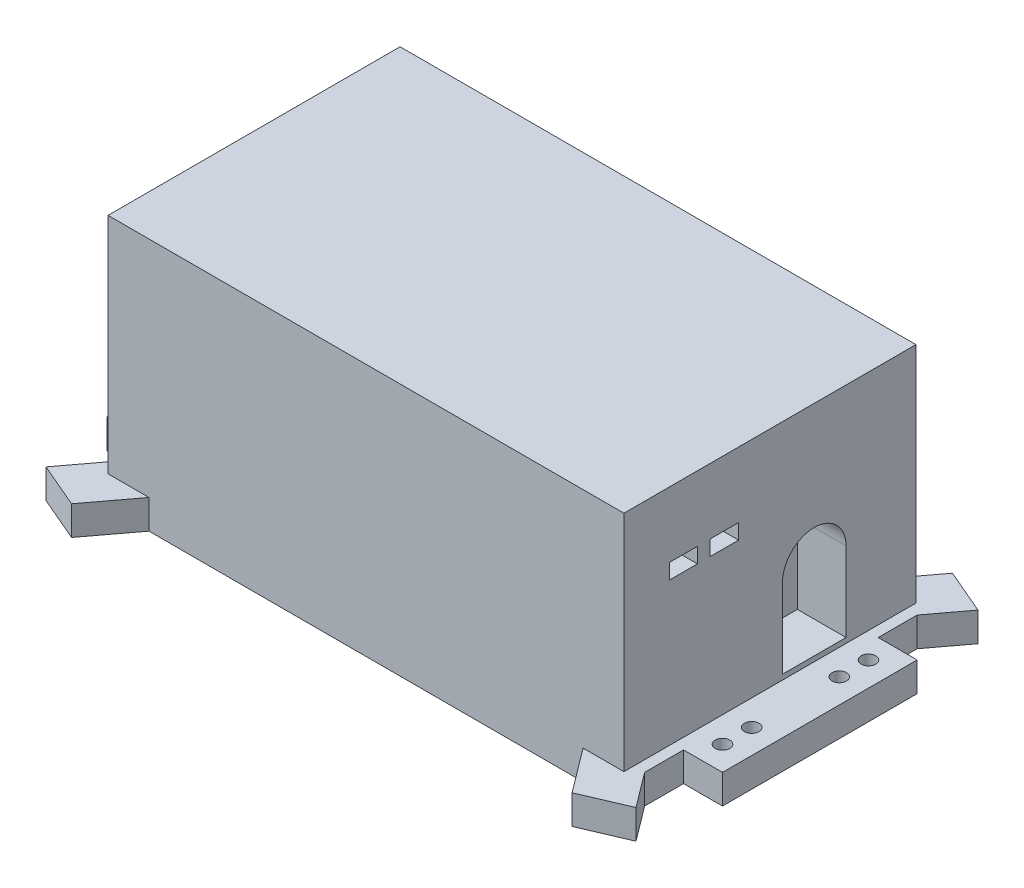
from build123d import *

# Parameters (mm, degrees)
SKETCH_1_R          = 1.5
EXTRUDE_1_DEPTH     = 6
SKETCH_2_W          = 106
SKETCH_2_H          = 60
EXTRUDE_2_DEPTH     = 46
SKETCH_3_R          = 2.913601035
SKETCH_3_W          = 27.829913336
SKETCH_3_H          = 14.266598172
SKETCH_3_W_2        = 28.231789341
SKETCH_3_W_3        = 5.927671071
SKETCH_3_H_2        = 3.014070036
SKETCH_3_W_4        = 6.731423082
SKETCH_3_H_3        = 3.918291047
CUT_EXTRUDE_1_DEPTH = 2
SKETCH_4_W          = 5.850937101
SKETCH_4_H          = 3.132319863
SKETCH_4_W_2        = 5.791836726
CUT_EXTRUDE_2_DEPTH = 10
SKETCH_5_W          = 25.590462272
SKETCH_5_H          = 8.924156589
CUT_EXTRUDE_3_DEPTH = 10


with BuildPart() as part:
    # 草图1 → 凸台-拉伸1 (new body)
    with BuildSketch(Plane(origin=(0, 0, 0), x_dir=(1, 0, 0), z_dir=(0, 1, 0))):
        Polygon((44.601753779, -30), (-44.601753779, -30), (-51.423054046, -39.075905643), (-60.615391847, -35.138784137), (-55.25, -28), (-55.25, -20), (-63.25, -20), (-63.25, 20), (-55.25, 20), (-55.25, 28), (-60.615391847, 35.138784137), (-51.423054046, 39.075905643), (-44.601753779, 30), (44.601753779, 30), (51.423054046, 39.075905643), (60.615391847, 35.138784137), (55.25, 28), (55.25, 20), (63.25, 20), (63.25, -20), (55.25, -20), (55.25, -28), (60.615391847, -35.138784137), (51.423054046, -39.075905643), align=None)
        with Locations(Location((58.25, 15, 0), (0, 0, 270))):
            Circle(SKETCH_1_R, mode=Mode.SUBTRACT)
        with Locations(Location((-58.25, 15, 0), (0, 0, 270))):
            Circle(SKETCH_1_R, mode=Mode.SUBTRACT)
        with Locations(Location((58.25, 9, 0), (0, 0, 270))):
            Circle(SKETCH_1_R, mode=Mode.SUBTRACT)
        with Locations(Location((-58.25, 9, 0), (0, 0, 270))):
            Circle(SKETCH_1_R, mode=Mode.SUBTRACT)
        with Locations(Location((58.25, -9, 0), (0, 0, 90))):
            Circle(SKETCH_1_R, mode=Mode.SUBTRACT)
        with Locations(Location((58.25, -15, 0), (0, 0, 90))):
            Circle(SKETCH_1_R, mode=Mode.SUBTRACT)
        with Locations(Location((-58.25, -9, 0), (0, 0, 90))):
            Circle(SKETCH_1_R, mode=Mode.SUBTRACT)
        with Locations(Location((-58.25, -15, 0), (0, 0, 90))):
            Circle(SKETCH_1_R, mode=Mode.SUBTRACT)
    extrude(amount=EXTRUDE_1_DEPTH)

    # 草图2 → 凸台-拉伸2 (add)
    with BuildSketch(Plane(origin=(0, 6, 0), x_dir=(1, 0, 0), z_dir=(0, 1, 0))):
        Rectangle(SKETCH_2_W, SKETCH_2_H)
    extrude(amount=EXTRUDE_2_DEPTH)

    # 草图3 → 切除-拉伸1 (cut)
    with BuildSketch(Plane(origin=(0, 0, -30), x_dir=(-1, 0, 0), z_dir=(0, 0, -1))):
        with Locations((7.233768087, 14.983525058)):
            Circle(SKETCH_3_R)
        with Locations((-28.282023842, 32.56560027)):
            Rectangle(SKETCH_3_W, SKETCH_3_H)
        with Locations((1.858676522, 32.56560027)):
            Rectangle(SKETCH_3_W_2, SKETCH_3_H)
        with Locations((-33.305473902, 14.481180052)):
            Rectangle(SKETCH_3_W_3, SKETCH_3_H_2)
        with Locations((-22.856697776, 14.029069547)):
            Rectangle(SKETCH_3_W_4, SKETCH_3_H_3)
        with Locations((-11.001355633, 14.029069547)):
            Rectangle(SKETCH_3_W_4, SKETCH_3_H_3)
    extrude(amount=-CUT_EXTRUDE_1_DEPTH, mode=Mode.SUBTRACT)

    # 草图4 → 切除-拉伸2 (cut)
    with BuildSketch(Plane(origin=(53, 0, 0), x_dir=(0, 0, -1), z_dir=(1, 0, 0))):
        with BuildLine():
            ThreePointArc((15.636259672, 23.370033323), (9.101457713, 29.904835281), (2.566655755, 23.370033323))
            Line((2.566655755, 23.370033323), (15.636259672, 23.370033323))
        make_face()
        with BuildLine():
            Line((15.636259672, 23.370033323), (2.566655755, 23.370033323))
            ThreePointArc((2.566655755, 23.370033323), (9.101457713, 16.835231365), (15.636259672, 23.370033323))
        make_face()
        with BuildLine():
            ThreePointArc((15.636259672, 23.370033323), (9.101457713, 16.835231365), (2.566655755, 23.370033323))
            Line((2.566655755, 23.370033323), (2.566655755, 7.058329889))
            Line((2.566655755, 7.058329889), (15.636259672, 7.058329889))
            Line((15.636259672, 7.058329889), (15.636259672, 23.370033323))
        make_face()
        with Locations((-9.3674094, 36.992669706)):
            Rectangle(SKETCH_4_W, SKETCH_4_H)
        with Locations((-17.789212803, 36.992669706)):
            Rectangle(SKETCH_4_W_2, SKETCH_4_H)
    extrude(amount=-CUT_EXTRUDE_2_DEPTH, mode=Mode.SUBTRACT)

    # 草图5 → 切除-拉伸3 (cut)
    with BuildSketch(Plane.ZY.offset(53)):
        with BuildLine():
            Line((10.519866707, 31.703186164), (10.519866707, 15.155081231))
            ThreePointArc((10.519866707, 15.155081231), (17.316409805, 21.951624329), (24.112952903, 15.155081231))
            Line((24.112952903, 15.155081231), (24.112952903, 31.703186164))
            Line((24.112952903, 31.703186164), (10.519866707, 31.703186164))
        make_face()
        with BuildLine():
            ThreePointArc((24.112952903, 15.155081231), (17.316409805, 21.951624329), (10.519866707, 15.155081231))
            Line((10.519866707, 15.155081231), (24.112952903, 15.155081231))
        make_face()
        with BuildLine():
            Line((24.112952903, 15.155081231), (10.519866707, 15.155081231))
            ThreePointArc((10.519866707, 15.155081231), (17.316409805, 8.358538134), (24.112952903, 15.155081231))
        make_face()
        with Locations((-5.821386914, 36.165264459)):
            Rectangle(SKETCH_5_W, SKETCH_5_H)
    extrude(amount=-CUT_EXTRUDE_3_DEPTH, mode=Mode.SUBTRACT)


solid = part.part
